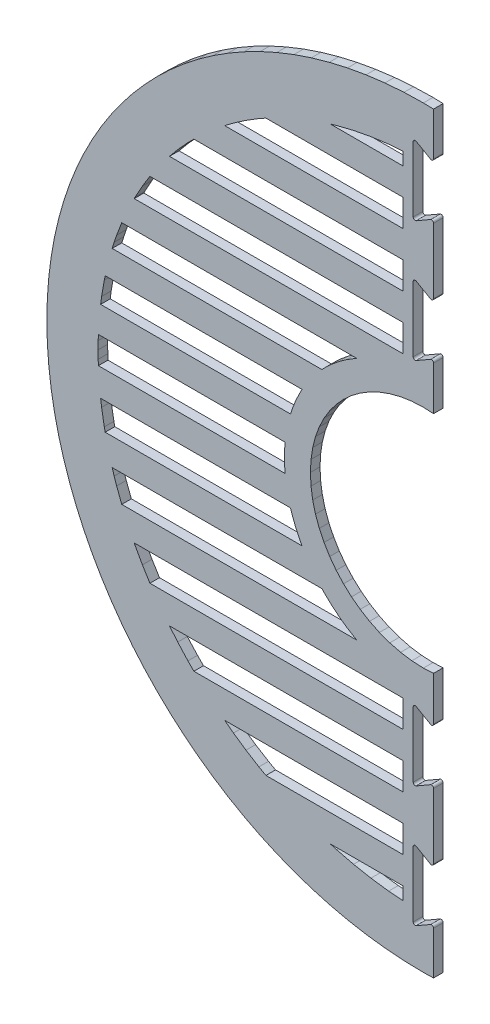
from build123d import *

# Parameters (mm, degrees)
BOSS_EXTRUDE1_DEPTH     = 3
SKETCH1_W               = 12.7
SKETCH1_H               = 78.71724042
BOSS_EXTRUDE2_DEPTH     = 3
CUT_EXTRUDE1_DEPTH      = 167.338711832
CUT_EXTRUDE1_DEPTH_BACK = 167.338711832
FILLET1_R               = 0.635


with BuildPart() as part:
    # Model → Boss-Extrude1 (new body)
    with BuildSketch(Plane.XY):
        Polygon((0, 117.60010003), (6.051687029, 117.447079513), (12.023921543, 116.992944005), (17.909328885, 116.245082492), (23.700512865, 115.210884088), (29.39008806, 113.897737665), (34.970669047, 112.313032431), (40.43484887, 110.464157343), (45.775263638, 108.358501524), (50.984495629, 106.003453763), (56.055180952, 103.40640352), (60.979923418, 100.574739583), (65.751326836, 97.515850067), (70.362005785, 94.237125778), (74.804585605, 90.745954831), (79.071637811, 87.049725342), (83.155820041, 83.155828116), (87.049725342, 79.071651268), (90.745946757, 74.804585605), (94.237120395, 70.362016551), (97.515839301, 65.751332219), (100.574739583, 60.979928801), (103.406392754, 56.055191718), (106.003456455, 50.984506395), (108.358502197, 45.775269021), (110.46416609, 40.434859636), (112.313041178, 34.97067443), (113.897742038, 29.390098826), (115.210883247, 23.700523631), (116.24507938, 17.90933965), (116.992945014, 12.023932309), (117.447073195, 6.051687029), (117.60010003, 0), (117.447073195, -6.051687029), (116.992945014, -12.023921543), (116.24507938, -17.909328885), (115.210883247, -23.700512865), (113.897742038, -29.39008806), (112.313041178, -34.970669047), (110.46416609, -40.43484887), (108.358502197, -45.775263638), (106.003456455, -50.984495629), (103.406392754, -56.055180952), (100.574739583, -60.979923418), (97.515839301, -65.751326836), (94.237120395, -70.362005785), (90.745946757, -74.804585605), (87.049725342, -79.071637811), (83.155820041, -83.155820041), (79.071637811, -87.049725342), (74.804585605, -90.745946757), (70.362005785, -94.237120395), (65.751326836, -97.515839301), (60.979923418, -100.574739583), (56.055180952, -103.406392754), (50.984495629, -106.003456455), (45.775263638, -108.358502197), (40.43484887, -110.46416609), (34.970669047, -112.313041178), (29.39008806, -113.897742038), (23.700512865, -115.210883247), (17.909328885, -116.24507938), (12.023921543, -116.992945014), (6.051687029, -117.447073195), (0, -117.60010003), (-6.051687029, -117.447073195), (-12.023932309, -116.992945014), (-17.90933965, -116.24507938), (-23.700523631, -115.210883247), (-29.390098826, -113.897742038), (-34.97067443, -112.313041178), (-40.434859636, -110.46416609), (-45.775269021, -108.358502197), (-50.984506395, -106.003456455), (-56.055191718, -103.406392754), (-60.979928801, -100.574739583), (-65.751332219, -97.515839301), (-70.362016551, -94.237120395), (-74.804585605, -90.745946757), (-79.071651268, -87.049725342), (-83.155828116, -83.155820041), (-87.049725342, -79.071637811), (-90.745954831, -74.804585605), (-94.237125778, -70.362005785), (-97.515850067, -65.751326836), (-100.574739583, -60.979923418), (-103.40640352, -56.055180952), (-106.003453763, -50.984495629), (-108.358501524, -45.775263638), (-110.464157343, -40.43484887), (-112.313032431, -34.970669047), (-113.897737665, -29.39008806), (-115.210884088, -23.700512865), (-116.245082492, -17.909328885), (-116.992944005, -12.023921543), (-117.447079513, -6.051687029), (-117.60010003, 0), (-117.447079513, 6.051687029), (-116.992944005, 12.023932309), (-116.245082492, 17.90933965), (-115.210884088, 23.700523631), (-113.897737665, 29.390098826), (-112.313032431, 34.97067443), (-110.464157343, 40.434859636), (-108.358501524, 45.775269021), (-106.003453763, 50.984506395), (-103.40640352, 56.055191718), (-100.574739583, 60.979928801), (-97.515850067, 65.751332219), (-94.237125778, 70.362016551), (-90.745954831, 74.804585605), (-87.049725342, 79.071651268), (-83.155828116, 83.155828116), (-79.071651268, 87.049725342), (-74.804585605, 90.745954831), (-70.362016551, 94.237125778), (-65.751332219, 97.515850067), (-60.979928801, 100.574739583), (-56.055191718, 103.40640352), (-50.984506395, 106.003453763), (-45.775269021, 108.358501524), (-40.434859636, 110.464157343), (-34.97067443, 112.313032431), (-29.390098826, 113.897737665), (-23.700523631, 115.210884088), (-17.90933965, 116.245082492), (-12.023932309, 116.992944005), (-6.051687029, 117.447079513), align=None)
        Polygon((-29.102476417, -97.366666667), (-27.13528383, -97.936097887), (-21.809747569, -99.25361006), (-16.377897814, -100.286923387), (-10.84801356, -101.02776964), (-5.228330739, -101.467880588), (-4.000003476, -101.514561632), (-4.000003476, -97.366666667), align=None, mode=Mode.SUBTRACT)
        Polygon((4.000003476, -91.556276279), (4.000003476, -100.566299099), (6.492250146, -101.473414273), (8.939925893, -101.290264384), (16.222340986, -100.392924669), (23.335321977, -98.992902459), (23.988802762, -98.831607395), align=None, mode=Mode.SUBTRACT)
        Polygon((-62.045190006, -80.433333333), (-59.311867396, -82.499830797), (-55.403896417, -85.178564792), (-51.367676375, -87.676991102), (-49.168106715, -88.9), (-4.000003476, -88.9), (-4.000003476, -80.433333333), align=None, mode=Mode.SUBTRACT)
        Polygon((4.000003476, -73.536187575), (4.000003476, -82.546231927), (37.246940528, -94.647129822), (41.334126451, -92.942776489), (45.583867052, -90.933424547), (48.111652035, -89.591516791), align=None, mode=Mode.SUBTRACT)
        Polygon((-79.298769188, -63.5), (-76.724758021, -66.604827711), (-73.545115217, -70.098003811), (-71.679238044, -71.966666667), (-4.000003476, -71.966666667), (-4.000003476, -63.5), align=None, mode=Mode.SUBTRACT)
        Polygon((4.000003476, -55.516109636), (4.000003476, -64.526164754), (57.399392615, -83.961950853), (57.645361667, -83.800741916), (61.41833335, -81.073281352), (65.058410475, -78.180004035), (65.414762539, -77.869256422), align=None, mode=Mode.SUBTRACT)
        Polygon((-90.310844655, -46.566666667), (-90.060738797, -47.072880385), (-87.754516517, -51.23540624), (-85.411504385, -55.033333333), (-4.000003476, -55.033333333), (-4.000003476, -46.566666667), align=None, mode=Mode.SUBTRACT)
        Polygon((13.918390316, -41.106039598), (13.664583672, -41.196311866), (9.141485511, -42.427007633), (4.436540137, -43.167638567), (4.000003476, -43.200829909), (4.000003476, -46.50607605), (72.408327908, -71.404685465), (75.126379055, -68.560113186), (78.180004035, -65.058410475), (78.527118937, -64.621701558), align=None, mode=Mode.SUBTRACT)
        Polygon((-97.207060507, -29.633333333), (-96.581674745, -31.625018395), (-95.803612041, -33.909773424), (-94.207018873, -38.1), (-20.760403781, -38.1), (-21.484821235, -37.70790507), (-23.989459483, -36.162822808), (-26.377653503, -34.45647778), (-28.641840235, -32.596470727), (-30.774429703, -30.590380859), (-31.684171761, -29.633333333), align=None, mode=Mode.SUBTRACT)
        Polygon((31.745338355, -29.574432966), (30.682537164, -30.682537164), (28.000917901, -33.14915017), (25.118880208, -35.386126031), (24.365470123, -35.898422496), (83.861224874, -57.553097704), (86.35691664, -53.744964515), (88.446776157, -50.212072923), align=None, mode=Mode.SUBTRACT)
        Polygon((40.777603573, -14.841837396), (40.573212518, -15.41651162), (39.112771946, -18.812073093), (37.378876919, -22.051065742), (37.093676843, -22.511029053), (92.335944451, -42.617575243), (92.942776489, -41.334137217), (94.758880107, -36.978922865), (95.557173326, -34.779972246), align=None, mode=Mode.SUBTRACT)
        Polygon((-100.812206247, -12.7), (-100.500605435, -14.999364387), (-99.660932043, -19.855226474), (-99.384550603, -21.166666667), (-37.885279041, -21.166666667), (-38.763756858, -19.519824897), (-40.007425563, -16.829129961), (-41.068956375, -14.04289822), (-41.493451352, -12.7), align=None, mode=Mode.SUBTRACT)
        Polygon((85.25455068, -4.000003476), (101.204567634, -9.805333879), (101.290264384, -8.939936659), (101.600086127, -4.000003476), align=None, mode=Mode.SUBTRACT)
        Polygon((43.200829909, -4.000003476), (43.167638567, -4.436540137), (42.932015567, -6.33851276), (42.887875281, -6.599877082), (98.134040154, -26.707844374), (98.417722236, -25.665466139), (99.981192695, -18.613075765), (100.020574443, -18.38443985), (60.499677107, -4.000003476), align=None, mode=Mode.SUBTRACT)
        Polygon((-101.506635221, 4.233333333), (-101.568938965, 2.540639496), (-101.600086127, 0), (-101.568938965, -2.540639496), (-101.506635221, -4.233333333), (-43.186177487, -4.233333333), (-43.194574907, -4.162784237), (-43.342019611, -2.09420895), (-43.39167205, 0), (-43.342019611, 2.09420895), (-43.194574907, 4.162795003), (-43.186177487, 4.233333333), align=None, mode=Mode.SUBTRACT)
        Polygon((101.204567634, 9.805344645), (85.25455068, 4.000003476), (101.600086127, 4.000003476), (101.290264384, 8.939936659), align=None, mode=Mode.SUBTRACT)
        Polygon((-99.384550603, 21.166666667), (-99.660932043, 19.855226474), (-100.500605435, 14.999364387), (-100.812206247, 12.7), (-41.493451352, 12.7), (-41.068956375, 14.04289822), (-40.007425563, 16.829140727), (-38.763756858, 19.519835663), (-37.885279041, 21.166666667), align=None, mode=Mode.SUBTRACT)
        Polygon((98.134040154, 26.707833608), (42.887886047, 6.599877082), (42.932015567, 6.338523526), (43.167638567, 4.436550903), (43.200829909, 4.000003476), (60.499677107, 4.000003476), (100.020574443, 18.384429084), (99.981192695, 18.613075765), (98.417722236, 25.665455373), align=None, mode=Mode.SUBTRACT)
        Polygon((0, 35.277783161), (-3.606950378, 35.095645269), (-7.10970815, 34.561063343), (-10.490531074, 33.691763475), (-13.731709205, 32.505482525), (-16.815489536, 31.019946586), (-19.724140591, 29.252892515), (-22.439941661, 27.222057173), (-24.945161268, 24.945161268), (-27.222057173, 22.439941661), (-29.252892515, 19.724140591), (-31.019946586, 16.815489536), (-32.505482525, 13.731709205), (-33.691763475, 10.490531074), (-34.561063343, 7.10970815), (-35.095645269, 3.606950378), (-35.277783161, 0), (-35.095645269, -3.606950378), (-34.561063343, -7.109697384), (-33.691763475, -10.490531074), (-32.505482525, -13.731698439), (-31.019946586, -16.81547877), (-29.252892515, -19.724140591), (-27.222057173, -22.439941661), (-24.945161268, -24.945150503), (-22.439941661, -27.222046407), (-19.724140591, -29.252887132), (-16.815489536, -31.019941203), (-13.731709205, -32.505477142), (-10.490531074, -33.691763475), (-7.10970815, -34.56105796), (-3.606950378, -35.095639886), (0, -35.277777778), (3.606950378, -35.095639886), (7.109697384, -34.56105796), (10.490531074, -33.691763475), (13.731698439, -32.505477142), (16.81547877, -31.019941203), (19.724140591, -29.252887132), (22.439941661, -27.222046407), (24.945150503, -24.945150503), (27.222046407, -22.439941661), (29.252887132, -19.724140591), (31.019941203, -16.81547877), (32.505477142, -13.731698439), (33.691763475, -10.490531074), (34.56105796, -7.109697384), (35.095639886, -3.606950378), (35.277777778, 0), (35.095639886, 3.606950378), (34.56105796, 7.10970815), (33.691763475, 10.490531074), (32.505477142, 13.731709205), (31.019941203, 16.815489536), (29.252887132, 19.724140591), (27.222046407, 22.439941661), (24.945150503, 24.945161268), (22.439941661, 27.222057173), (19.724140591, 29.252892515), (16.81547877, 31.019946586), (13.731698439, 32.505482525), (10.490531074, 33.691763475), (7.109697384, 34.561063343), (3.606950378, 35.095645269), align=None, mode=Mode.SUBTRACT)
        Polygon((-94.207016182, 38.100005383), (-95.803612041, 33.909768041), (-96.581674745, 31.625018395), (-97.207056469, 29.633338716), (-31.684171761, 29.633338716), (-30.774429703, 30.590391625), (-28.641840235, 32.596481493), (-26.377653503, 34.456488546), (-23.989459483, 36.162828191), (-21.484821235, 37.707915836), (-20.760403781, 38.100005383), align=None, mode=Mode.SUBTRACT)
        Polygon((92.335944451, 42.61756986), (37.093687609, 22.511029053), (37.378876919, 22.051076508), (39.112771946, 18.812083859), (40.573212518, 15.416522386), (40.777603573, 14.841837396), (95.557173326, 34.779972246), (94.758880107, 36.978922865), (92.942776489, 41.334126451), align=None, mode=Mode.SUBTRACT)
        Polygon((-85.411499002, 55.033338716), (-87.754516517, 51.23540624), (-90.060738797, 47.072880385), (-90.310841963, 46.56667205), (-4.000003476, 46.56667205), (-4.000003476, 55.033338716), align=None, mode=Mode.SUBTRACT)
        Polygon((83.861203342, 57.553103087), (24.365470123, 35.898422496), (25.118880208, 35.386136797), (28.000917901, 33.149155553), (30.682537164, 30.682542547), (31.745338355, 29.574438349), (88.446776157, 50.212072923), (86.35691664, 53.744959132), align=None, mode=Mode.SUBTRACT)
        Polygon((72.408327908, 71.404680083), (4.000003476, 46.506081433), (4.000003476, 43.200840675), (4.436540137, 43.16764395), (9.141485511, 42.427018399), (13.664583672, 41.196322632), (13.918411848, 41.106044981), (78.527118937, 64.621696175), (78.180004035, 65.058410475), (75.126379055, 68.56010242), align=None, mode=Mode.SUBTRACT)
        Polygon((-71.679232661, 71.96667205), (-73.545115217, 70.098009194), (-76.724758021, 66.604833094), (-79.298761113, 63.500005383), (-4.000003476, 63.500005383), (-4.000003476, 71.96667205), align=None, mode=Mode.SUBTRACT)
        Polygon((57.399392615, 83.96194547), (4.000003476, 64.526159371), (4.000003476, 55.516120402), (65.414741007, 77.869259114), (65.058410475, 78.179995961), (61.41833335, 81.073281352), (57.645361667, 83.800749991), align=None, mode=Mode.SUBTRACT)
        Polygon((-49.168106715, 88.900002691), (-51.367676375, 87.676985719), (-55.403896417, 85.178562101), (-59.311867396, 82.499833488), (-62.045190006, 80.433336025), (-4.000003476, 80.433336025), (-4.000003476, 88.900002691), align=None, mode=Mode.SUBTRACT)
        Polygon((37.246929762, 94.64712713), (4.000003476, 82.546229235), (4.000003476, 73.536201032), (48.111641269, 89.591522174), (45.583867052, 90.933419164), (41.334126451, 92.942771106), align=None, mode=Mode.SUBTRACT)
        Polygon((6.492250146, 101.473410236), (4.000003476, 100.56630852), (4.000003476, 91.556270896), (23.988813527, 98.831602012), (23.335321977, 98.992911879), (16.222340986, 100.392930052), (8.939925893, 101.290272458), align=None, mode=Mode.SUBTRACT)
        Polygon((-4.000003476, 101.514556249), (-5.228330739, 101.46788328), (-10.84801356, 101.027766948), (-16.377897814, 100.286920696), (-21.809747569, 99.25361006), (-27.13528383, 97.936097887), (-29.1024818, 97.366669358), (-4.000003476, 97.366669358), align=None, mode=Mode.SUBTRACT)
    extrude(amount=BOSS_EXTRUDE1_DEPTH)

    # Sketch1 → Boss-Extrude2 (add)
    with BuildSketch(Plane.XY.offset(3)):
        with Locations((0, -74.636403371)):
            Rectangle(SKETCH1_W, SKETCH1_H)
        with Locations((0, 74.636403371)):
            Rectangle(SKETCH1_W, SKETCH1_H)
    extrude(amount=-BOSS_EXTRUDE2_DEPTH)

    # Sketch4 → Cut-Extrude1 (cut, two sides: drawn at the far end of the back side and taken through both)
    with BuildSketch(Plane.XY.offset(3).offset(-CUT_EXTRUDE1_DEPTH_BACK)):
        Polygon((-3.175, 106.631290014), (-3.175, 84.058941595), (3.175, 87.725115805), (3.175, 65.152767386), (-3.175, 68.818941595), (-3.175, 46.246593177), (3.175, 49.912767386), (3.175, -49.912767386), (-3.175, -46.246593177), (-3.175, -68.818941595), (3.175, -65.152767386), (3.175, -87.725115805), (-3.175, -84.058941595), (-3.175, -106.631290014), (3.175, -102.965115805), (3.175, -252.374161815), (344.43133491, -252.374161815), (344.43133491, 252.374161815), (3.175, 252.374161815), (3.175, 102.965115805), align=None)
    extrude(amount=CUT_EXTRUDE1_DEPTH + CUT_EXTRUDE1_DEPTH_BACK, mode=Mode.SUBTRACT)

    # Fillet1
    fillet1_edges = [part.edges().sort_by_distance(p)[0] for p in [
        (-3.175, -46.246593177, 1.5),
        (3.175, -49.912767386, 1.5),
        (3.175, 49.912767386, 1.5),
        (-3.175, 46.246593177, 1.5),
        (-3.175, 68.818941595, 1.5),
        (3.175, 65.152767386, 1.5),
        (3.175, 87.725115805, 1.5),
        (-3.175, 84.058941595, 1.5),
        (-3.175, 106.631290014, 1.5),
        (3.175, 102.965115805, 1.5),
        (3.175, -102.965115805, 1.5),
        (-3.175, -106.631290014, 1.5),
        (-3.175, -84.058941595, 1.5),
        (3.175, -87.725115805, 1.5),
        (3.175, -65.152767386, 1.5),
        (-3.175, -68.818941595, 1.5),
    ]]
    fillet(fillet1_edges, radius=FILLET1_R)


solid = part.part
